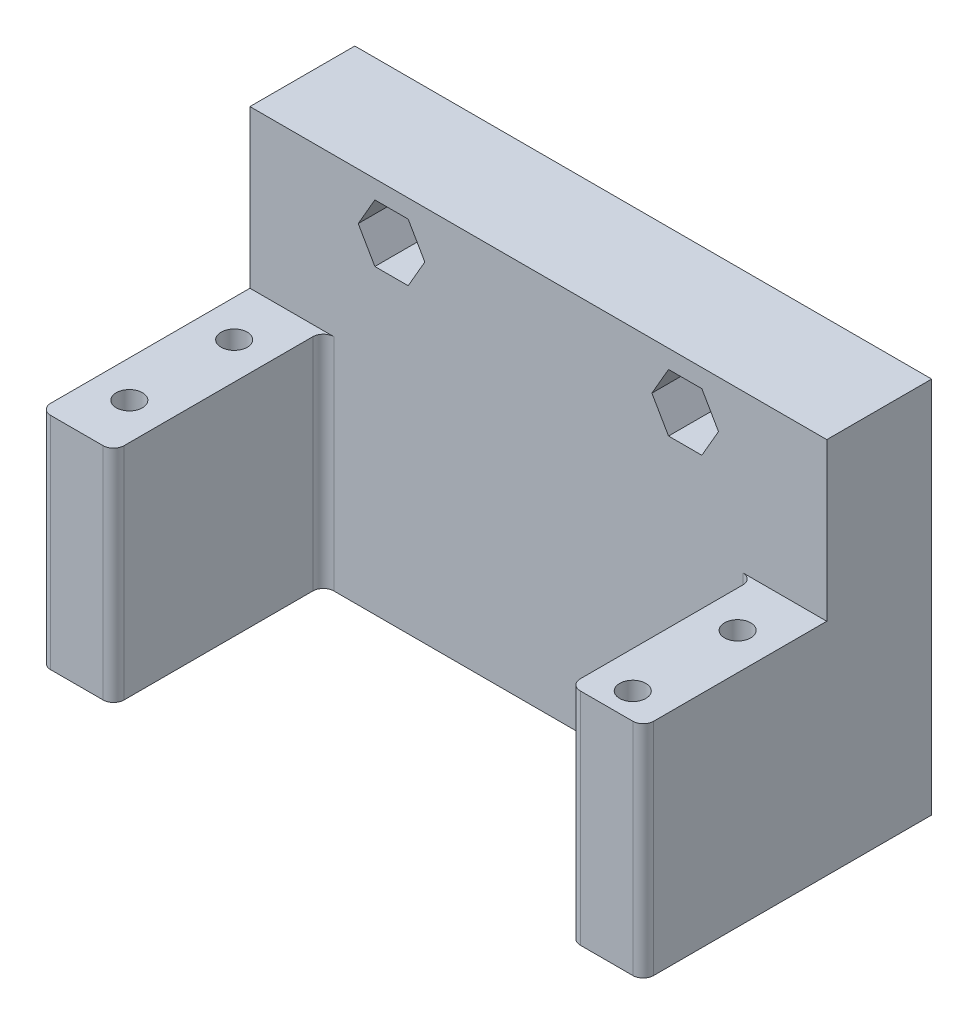
from build123d import *

# Parameters (mm, degrees)
SKETCH1_W           = 55
SKETCH1_H           = 36
SKETCH1_R           = 2
BOSS_EXTRUDE1_DEPTH = 10
SKETCH2_W           = 7
SKETCH2_H           = 20
SKETCH2_H_2         = 17.5
BOSS_EXTRUDE2_DEPTH = 21
SKETCH3_R           = 1.25
CUT_EXTRUDE1_DEPTH  = 10
CUT_EXTRUDE2_DEPTH  = 5.5
LPATTERN1_COUNT     = 2
LPATTERN1_PITCH     = 28
FILLET1_R           = 1


with BuildPart() as part:
    # Sketch1 → Boss-Extrude1 (new body)
    with BuildSketch(Plane.XY):
        with Locations((27.5, -18)):
            Rectangle(SKETCH1_W, SKETCH1_H)
        with Locations((13.5, -4.5)):
            Circle(SKETCH1_R, mode=Mode.SUBTRACT)
        with Locations((41.5, -4.5)):
            Circle(SKETCH1_R, mode=Mode.SUBTRACT)
    extrude(amount=BOSS_EXTRUDE1_DEPTH)

    # Sketch2 → Boss-Extrude2 (add)
    with BuildSketch(Plane.XZ.offset(36)):
        with Locations((3.5, 20)):
            Rectangle(SKETCH2_W, SKETCH2_H)
        with Locations((51.5, 18.75)):
            Rectangle(SKETCH2_W, SKETCH2_H_2)
    extrude(amount=-BOSS_EXTRUDE2_DEPTH)

    # Sketch3 → Cut-Extrude1 (cut)
    with BuildSketch(Plane(origin=(0, -15, 0), x_dir=(1, 0, 0), z_dir=(0, 1, 0))):
        with Locations(Location((3.5, -15, 0), (0, 0, 270))):
            Circle(SKETCH3_R)
        with Locations(Location((51.5, -15, 0), (0, 0, 270))):
            Circle(SKETCH3_R)
        with Locations(Location((51.5, -25, 0), (0, 0, 270))):
            Circle(SKETCH3_R)
        with Locations(Location((3.5, -25, 0), (0, 0, 270))):
            Circle(SKETCH3_R)
    extrude(amount=-CUT_EXTRUDE1_DEPTH, mode=Mode.SUBTRACT)

    # Sketch4 → Cut-Extrude2 (cut)
    with BuildSketch(Plane.XY.offset(10)):
        Polygon((11.91228676, -1.75), (10.324573519, -4.5), (11.91228676, -7.25), (15.08771324, -7.25), (16.675426481, -4.5), (15.08771324, -1.75), align=None)
    cut_extrude2 = extrude(amount=-CUT_EXTRUDE2_DEPTH, mode=Mode.SUBTRACT)

    # LPattern1: Cut-Extrude2 ×2
    with Locations(*[(i * LPATTERN1_PITCH, 0, 0) for i in range(1, LPATTERN1_COUNT)]):
        add(cut_extrude2, mode=Mode.SUBTRACT)

    # Fillet1
    fillet1_edges = [part.edges().sort_by_distance(p)[0] for p in [
        (0, -25.5, 30),
        (7, -25.5, 30),
        (7, -25.5, 10),
        (55, -25.5, 27.5),
        (48, -25.5, 10),
        (48, -25.5, 27.5),
    ]]
    fillet(fillet1_edges, radius=FILLET1_R)


solid = part.part
